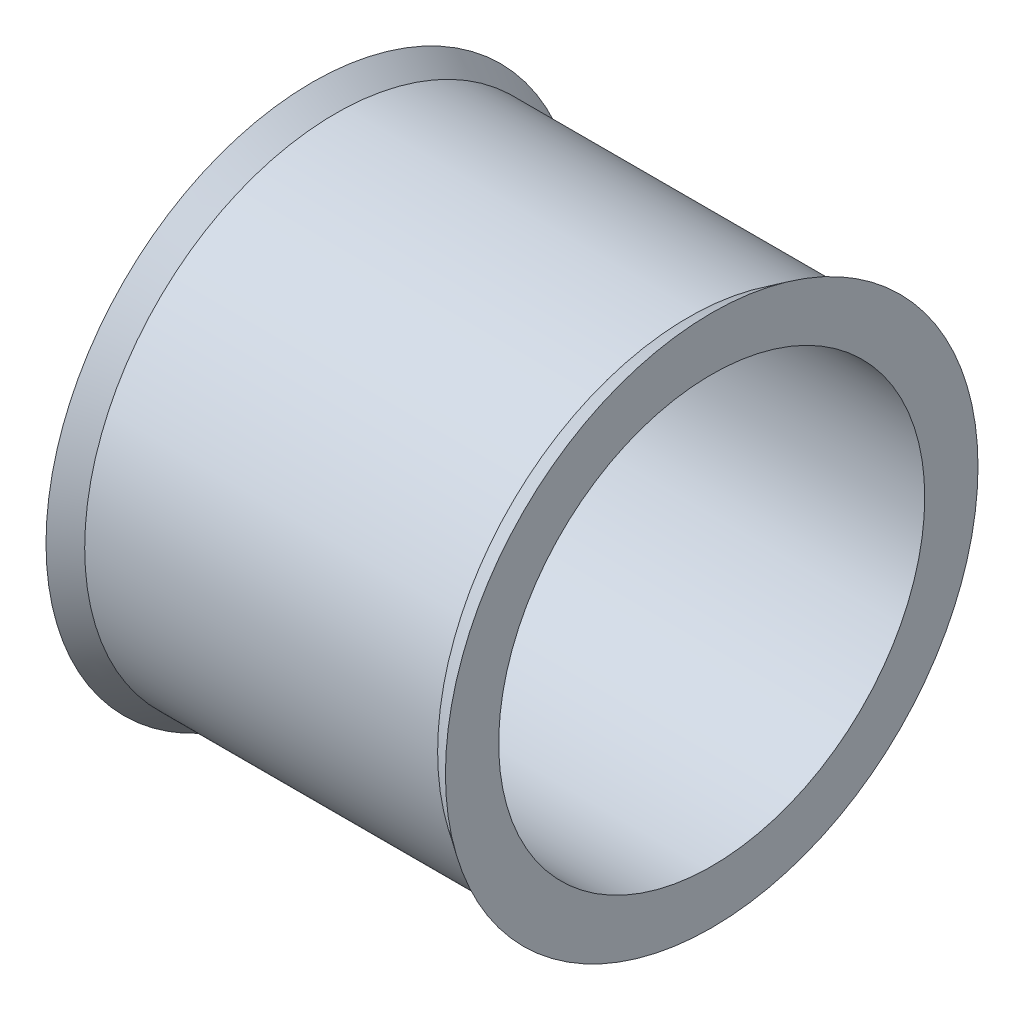
from build123d import *


with BuildPart() as part:
    # Sketch1 → Revolve1 (revolve)
    with BuildSketch(Plane.XY, mode=Mode.PRIVATE) as revolve1_sk:
        Polygon((-7.398321298, 80), (-157.398321298, 80), (-157.398321298, 100), (-148.669689441, 94.199880527), (-16.126953155, 94.199880527), (-7.398321298, 100), align=None)
    revolve(revolve1_sk.sketch.rotate(Axis((0, 0, 0), (-1, 0, 0)), 90), axis=Axis((0, 0, 0), (-1, 0, 0)))


solid = part.part
